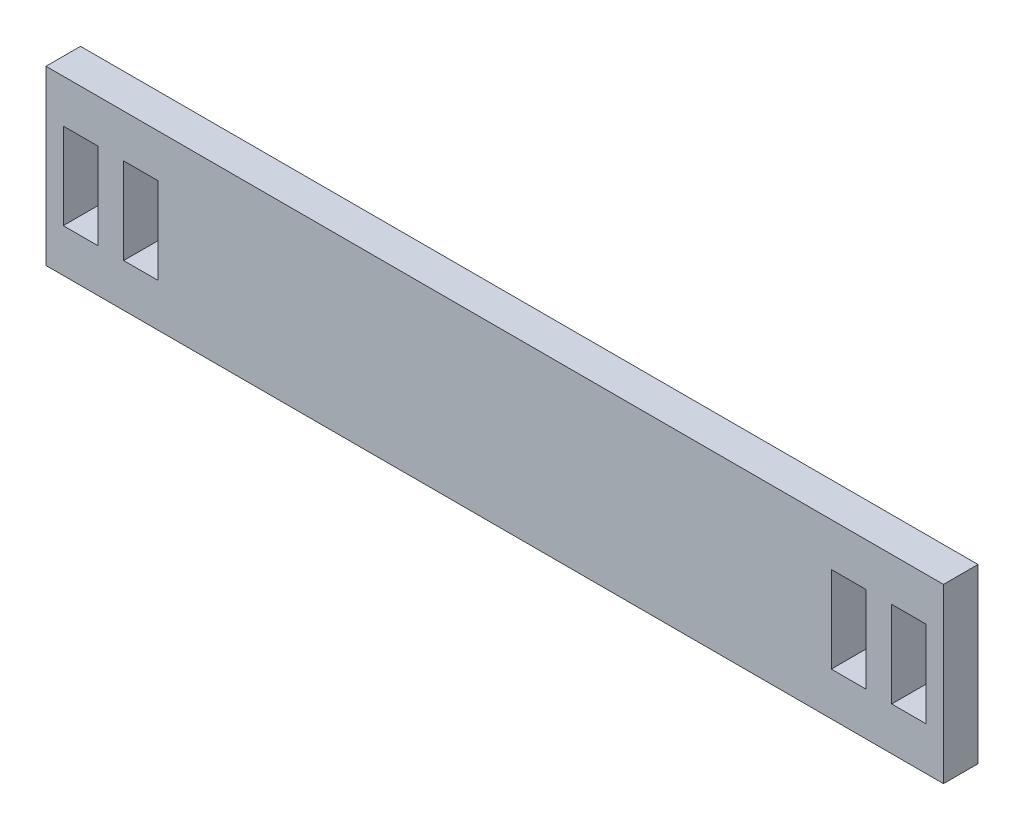
from build123d import *

# Parameters (mm, degrees)
SKETCH_1_W      = 4
SKETCH_1_H      = 10
EXTRUDE_1_DEPTH = 2


with BuildPart() as part:
    # 草图1 → 凸台-拉伸1 (new, symmetric)
    with BuildSketch(Plane.XY):
        Polygon((-46, 0), (46, 0), (52, 0), (52, 20), (46, 20), (-46, 20), (-52, 20), (-52, 0), align=None)
        with Locations((48, 10)):
            Rectangle(SKETCH_1_W, SKETCH_1_H, mode=Mode.SUBTRACT)
        with Locations((-48, 10)):
            Rectangle(SKETCH_1_W, SKETCH_1_H, mode=Mode.SUBTRACT)
        with Locations((41, 10)):
            Rectangle(SKETCH_1_W, SKETCH_1_H, mode=Mode.SUBTRACT)
        with Locations((-41, 10)):
            Rectangle(SKETCH_1_W, SKETCH_1_H, mode=Mode.SUBTRACT)
    extrude(amount=EXTRUDE_1_DEPTH, both=True)


solid = part.part
